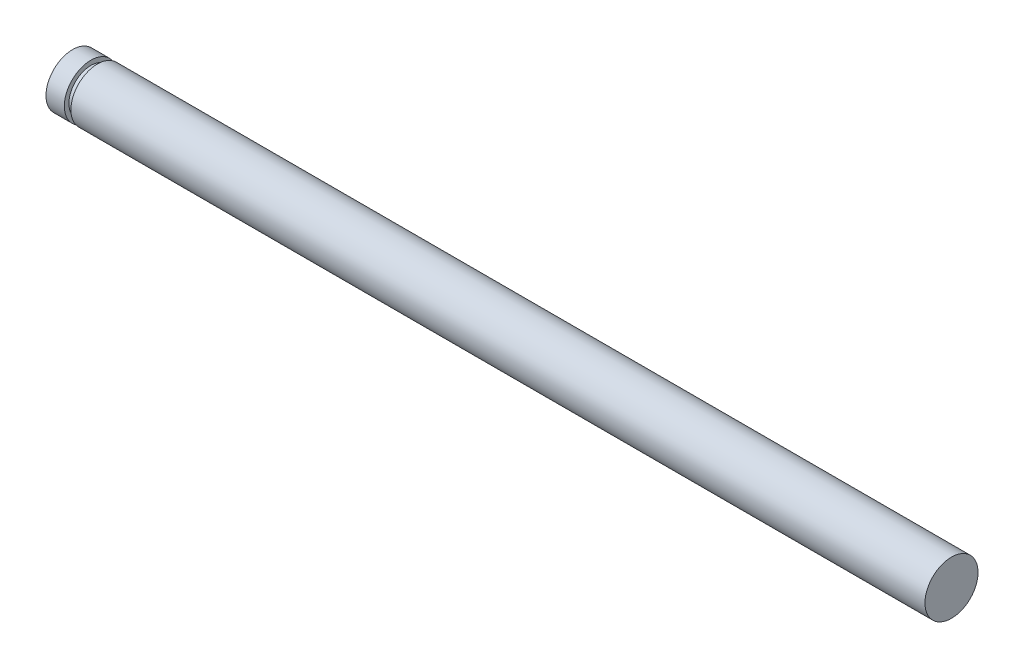
from build123d import *


with BuildPart() as part:
    # Sketch2 → Revolve1 (revolve)
    with BuildSketch(Plane.XY, mode=Mode.PRIVATE) as revolve1_sk:
        Polygon((-304.8, 0), (-304.8, 18.415), (-292.1, 18.415), (-292.1, 15.24), (-287.528, 15.24), (-287.528, 18.415), (304.8, 18.415), (304.8, 0), align=None)
    revolve(revolve1_sk.sketch.rotate(Axis((-304.8, 0, 0), (1, 0, 0)), 90), axis=Axis((-304.8, 0, 0), (1, 0, 0)))


solid = part.part
